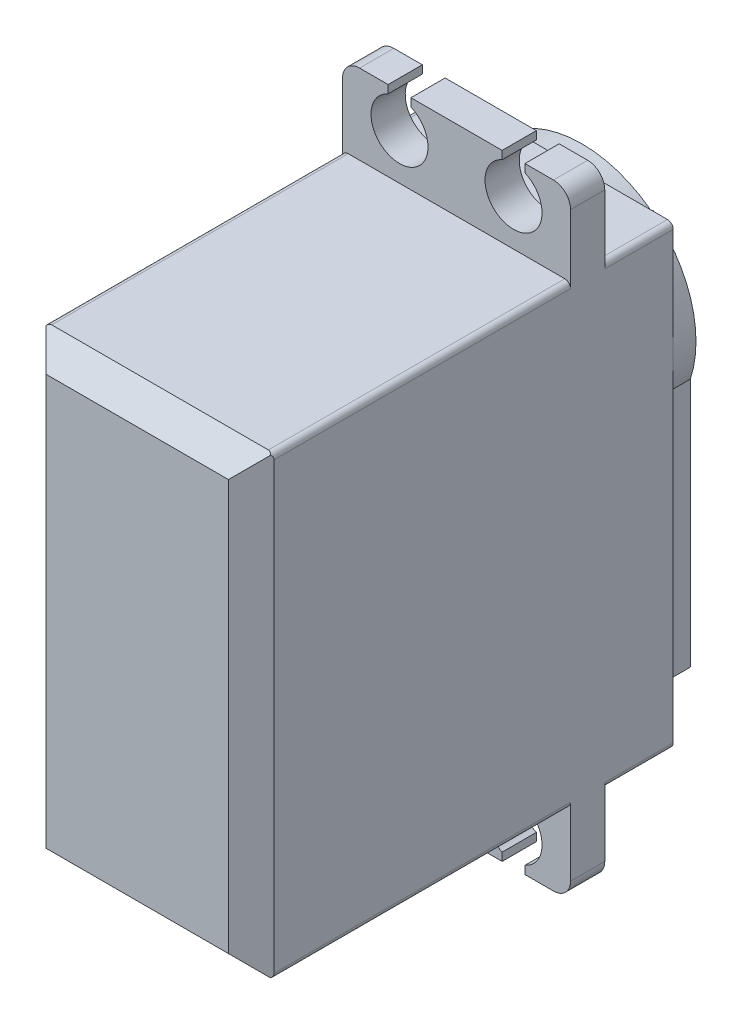
from build123d import *

# Parameters (mm, degrees)
BOSS_EXTRU_1_DEPTH      = 20
BOSS_EXTRU_2_DEPTH      = 2
ESQUISSE3_R             = 6.5
BOSS_EXTRU_3_DEPTH      = 1
ESQUISSE4_R             = 5.5
BOSS_EXTRU_4_DEPTH      = 0.25
ESQUISSE5_R             = 3
BOSS_EXTRU_5_DEPTH      = 4
ENL_V_START             = -4
ENL_V_MAT_EXTRU_1_DEPTH = 4
ENL_V_MAT_EXTRU_2_DEPTH = 46.716517803
CONG_1_R                = 1.5
CHANFREIN1_SIZE         = 2
CONG_2_R                = 0.5


with BuildPart() as part:
    # Esquisse1 → Boss.-Extru.1 (new body)
    with BuildSketch(Plane(origin=(0, 0, 0), x_dir=(0, 0, -1), z_dir=(1, 0, 0))):
        Polygon((0, -20), (0, 20), (28, 20), (28, 27), (31, 27), (31, 20), (37, 20), (37, -20), (31, -20), (31, -27), (28, -27), (28, -20), align=None)
    extrude(amount=BOSS_EXTRU_1_DEPTH)

    # Esquisse2 → Boss.-Extru.2 (add)
    with BuildSketch(Plane(origin=(0, 0, -37), x_dir=(-1, 0, 0), z_dir=(0, 0, -1))):
        with BuildLine():
            ThreePointArc((-0.5, 6.877501001), (-10, 20), (-19.5, 6.877501001))
            Line((-19.5, 6.877501001), (-19.5, -15))
            Line((-19.5, -15), (-14.898979486, -15))
            ThreePointArc((-14.898979486, -15), (-10, -17), (-5.101020514, -15))
            Line((-5.101020514, -15), (-0.5, -15))
            Line((-0.5, -15), (-0.5, 6.877501001))
        make_face()
    extrude(amount=BOSS_EXTRU_2_DEPTH)

    # Esquisse3 → Boss.-Extru.3 (add)
    with BuildSketch(Plane(origin=(0, 0, -39), x_dir=(-1, 0, 0), z_dir=(0, 0, -1))):
        with Locations((-10, 10)):
            Circle(ESQUISSE3_R)
    extrude(amount=BOSS_EXTRU_3_DEPTH)

    # Esquisse4 → Boss.-Extru.4 (add)
    with BuildSketch(Plane(origin=(0, 0, -40), x_dir=(-1, 0, 0), z_dir=(0, 0, -1))):
        with Locations((-10, 10)):
            Circle(ESQUISSE4_R)
    extrude(amount=BOSS_EXTRU_4_DEPTH)

    # Esquisse5 → Boss.-Extru.5 (add)
    with BuildSketch(Plane(origin=(0, 0, -40.25), x_dir=(-1, 0, 0), z_dir=(0, 0, -1))):
        with Locations((-10, 10)):
            Circle(ESQUISSE5_R)
    extrude(amount=BOSS_EXTRU_5_DEPTH)

    # Esquisse6 → Enlèv. mat.-Extru.1 (cut)
    with BuildSketch(Plane(origin=(0, 0, -44.25), x_dir=(-1, 0, 0), z_dir=(0, 0, -1)).offset(ENL_V_START)):
        with BuildLine():
            ThreePointArc((-8.97393957, 12.819077862), (-9.479055467, 12.954423259), (-10, 13))
            Line((-10, 13), (-9.565879556, 12.462019383))
            Line((-9.565879556, 12.462019383), (-8.97393957, 12.819077862))
        make_face()
        with BuildLine():
            Line((-10.434120444, 12.462019383), (-10, 13))
            ThreePointArc((-10, 13), (-10.520944533, 12.954423259), (-11.02606043, 12.819077862))
            Line((-11.02606043, 12.819077862), (-10.434120444, 12.462019383))
        make_face()
        with BuildLine():
            ThreePointArc((-8.071637171, 12.298133329), (-8.5, 12.598076211), (-8.97393957, 12.819077862))
            Line((-8.97393957, 12.819077862), (-8.75, 12.165063509))
            Line((-8.75, 12.165063509), (-8.071637171, 12.298133329))
        make_face()
        with BuildLine():
            Line((-11.25, 12.165063509), (-11.02606043, 12.819077862))
            ThreePointArc((-11.02606043, 12.819077862), (-11.5, 12.598076211), (-11.928362829, 12.298133329))
            Line((-11.928362829, 12.298133329), (-11.25, 12.165063509))
        make_face()
        with BuildLine():
            ThreePointArc((-7.401923789, 11.5), (-7.701866671, 11.928362829), (-8.071637171, 12.298133329))
            Line((-8.071637171, 12.298133329), (-8.084888892, 11.606969024))
            Line((-8.084888892, 11.606969024), (-7.401923789, 11.5))
        make_face()
        with BuildLine():
            Line((-11.915111108, 11.606969024), (-11.928362829, 12.298133329))
            ThreePointArc((-11.928362829, 12.298133329), (-12.298133329, 11.928362829), (-12.598076211, 11.5))
            Line((-12.598076211, 11.5), (-11.915111108, 11.606969024))
        make_face()
        with BuildLine():
            ThreePointArc((-7.045576741, 10.520944533), (-7.180922138, 11.02606043), (-7.401923789, 11.5))
            Line((-7.401923789, 11.5), (-7.650768448, 10.855050358))
            Line((-7.650768448, 10.855050358), (-7.045576741, 10.520944533))
        make_face()
        with BuildLine():
            Line((-12.349231552, 10.855050358), (-12.598076211, 11.5))
            ThreePointArc((-12.598076211, 11.5), (-12.819077862, 11.02606043), (-12.954423259, 10.520944533))
            Line((-12.954423259, 10.520944533), (-12.349231552, 10.855050358))
        make_face()
        with BuildLine():
            ThreePointArc((-7.045576741, 9.479055467), (-7, 10), (-7.045576741, 10.520944533))
            Line((-7.045576741, 10.520944533), (-7.5, 10))
            Line((-7.5, 10), (-7.045576741, 9.479055467))
        make_face()
        with BuildLine():
            Line((-12.5, 10), (-12.954423259, 10.520944533))
            ThreePointArc((-12.954423259, 10.520944533), (-13, 10), (-12.954423259, 9.479055467))
            Line((-12.954423259, 9.479055467), (-12.5, 10))
        make_face()
        with BuildLine():
            Line((-12.349231552, 9.144949642), (-12.954423259, 9.479055467))
            ThreePointArc((-12.954423259, 9.479055467), (-12.819077862, 8.97393957), (-12.598076211, 8.5))
            Line((-12.598076211, 8.5), (-12.349231552, 9.144949642))
        make_face()
        with BuildLine():
            ThreePointArc((-7.401923789, 8.5), (-7.180922138, 8.97393957), (-7.045576741, 9.479055467))
            Line((-7.045576741, 9.479055467), (-7.650768448, 9.144949642))
            Line((-7.650768448, 9.144949642), (-7.401923789, 8.5))
        make_face()
        with BuildLine():
            Line((-11.915111108, 8.393030976), (-12.598076211, 8.5))
            ThreePointArc((-12.598076211, 8.5), (-12.298133329, 8.071637171), (-11.928362829, 7.701866671))
            Line((-11.928362829, 7.701866671), (-11.915111108, 8.393030976))
        make_face()
        with BuildLine():
            ThreePointArc((-8.071637171, 7.701866671), (-7.701866671, 8.071637171), (-7.401923789, 8.5))
            Line((-7.401923789, 8.5), (-8.084888892, 8.393030976))
            Line((-8.084888892, 8.393030976), (-8.071637171, 7.701866671))
        make_face()
        with BuildLine():
            Line((-11.25, 7.834936491), (-11.928362829, 7.701866671))
            ThreePointArc((-11.928362829, 7.701866671), (-11.5, 7.401923789), (-11.02606043, 7.180922138))
            Line((-11.02606043, 7.180922138), (-11.25, 7.834936491))
        make_face()
        with BuildLine():
            ThreePointArc((-8.97393957, 7.180922138), (-8.5, 7.401923789), (-8.071637171, 7.701866671))
            Line((-8.071637171, 7.701866671), (-8.75, 7.834936491))
            Line((-8.75, 7.834936491), (-8.97393957, 7.180922138))
        make_face()
        with BuildLine():
            Line((-10.434120444, 7.537980617), (-11.02606043, 7.180922138))
            ThreePointArc((-11.02606043, 7.180922138), (-10.520944533, 7.045576741), (-10, 7))
            Line((-10, 7), (-10.434120444, 7.537980617))
        make_face()
        with BuildLine():
            ThreePointArc((-10, 7), (-9.479055467, 7.045576741), (-8.97393957, 7.180922138))
            Line((-8.97393957, 7.180922138), (-9.565879556, 7.537980617))
            Line((-9.565879556, 7.537980617), (-10, 7))
        make_face()
    extrude(amount=ENL_V_MAT_EXTRU_1_DEPTH, mode=Mode.SUBTRACT)

    # Esquisse7 → Enlèv. mat.-Extru.2 (cut, through all)
    with BuildSketch(Plane(origin=(0, 0, -31), x_dir=(-1, 0, 0), z_dir=(0, 0, -1))):
        with BuildLine():
            Line((-4, 27), (-6, 27))
            Line((-6, 27), (-6, 26.291287847))
            ThreePointArc((-6, 26.291287847), (-5, 21.5), (-4, 26.291287847))
            Line((-4, 26.291287847), (-4, 27))
        make_face()
        with BuildLine():
            Line((-14, 26.291287847), (-14, 27))
            Line((-14, 27), (-16, 27))
            Line((-16, 27), (-16, 26.291287847))
            ThreePointArc((-16, 26.291287847), (-15, 21.5), (-14, 26.291287847))
        make_face()
        with BuildLine():
            Line((-6, -27), (-4, -27))
            Line((-4, -27), (-4, -26.291287847))
            ThreePointArc((-4, -26.291287847), (-5, -21.5), (-6, -26.291287847))
            Line((-6, -26.291287847), (-6, -27))
        make_face()
        with BuildLine():
            Line((-16, -27), (-14, -27))
            Line((-14, -27), (-14, -26.291287847))
            ThreePointArc((-14, -26.291287847), (-15, -21.5), (-16, -26.291287847))
            Line((-16, -26.291287847), (-16, -27))
        make_face()
    extrude(amount=-ENL_V_MAT_EXTRU_2_DEPTH, mode=Mode.SUBTRACT)

    # Congé1
    cong_1_edges = [part.edges().sort_by_distance(p)[0] for p in [
        (0, -27, -29.5),
        (0, 27, -29.5),
        (20, 27, -29.5),
        (20, -27, -29.5),
    ]]
    fillet(cong_1_edges, radius=CONG_1_R)

    # Chanfrein1
    chanfrein1_edges = [part.edges().sort_by_distance(p)[0] for p in [
        (0, 0, 0),
        (10, -20, 0),
        (10, 20, 0),
        (20, 0, 0),
    ]]
    chamfer(chanfrein1_edges, length=CHANFREIN1_SIZE)

    # Congé2
    cong_2_edges = [part.edges().sort_by_distance(p)[0] for p in [
        (20, 20, -34),
        (0, 20, -15),
        (0, 20, -34),
        (0, -20, -34),
        (20, 20, -15),
        (20, -20, -15),
        (0, -20, -15),
        (20, -20, -34),
    ]]
    fillet(cong_2_edges, radius=CONG_2_R)


solid = part.part
